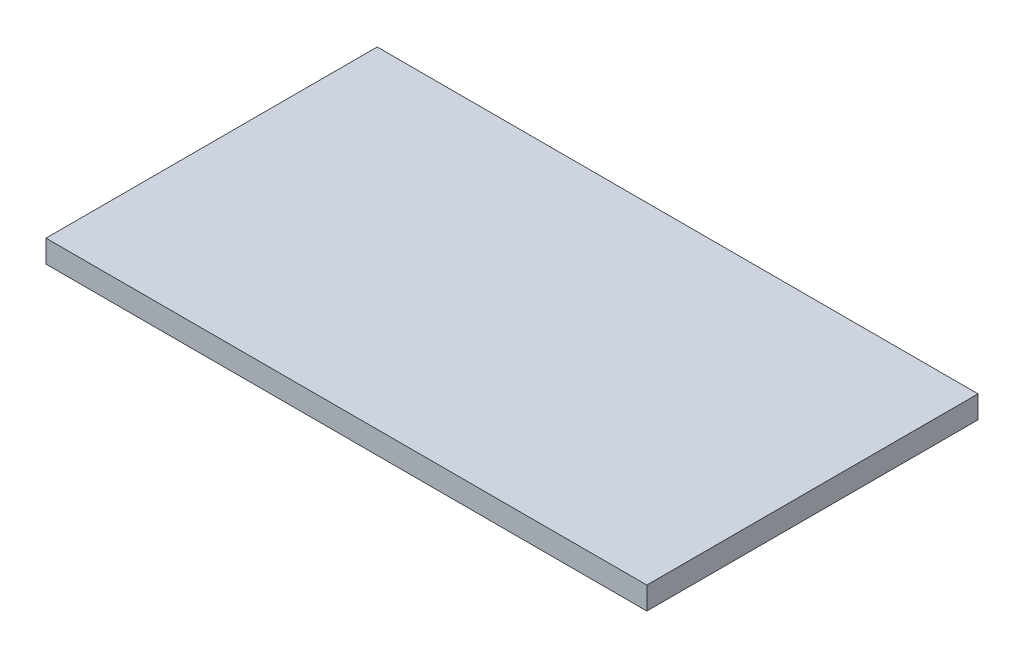
from build123d import *

# Parameters (mm, degrees)
CROQUIS1_W              = 254
CROQUIS1_H              = 140
SALIENTE_EXTRUIR1_DEPTH = 9.525


with BuildPart() as part:
    # Croquis1 → Saliente-Extruir1 (new body)
    with BuildSketch(Plane(origin=(0, 0, 0), x_dir=(1, 0, 0), z_dir=(0, 1, 0))):
        with Locations((127, 70)):
            Rectangle(CROQUIS1_W, CROQUIS1_H)
    extrude(amount=SALIENTE_EXTRUIR1_DEPTH)


solid = part.part
